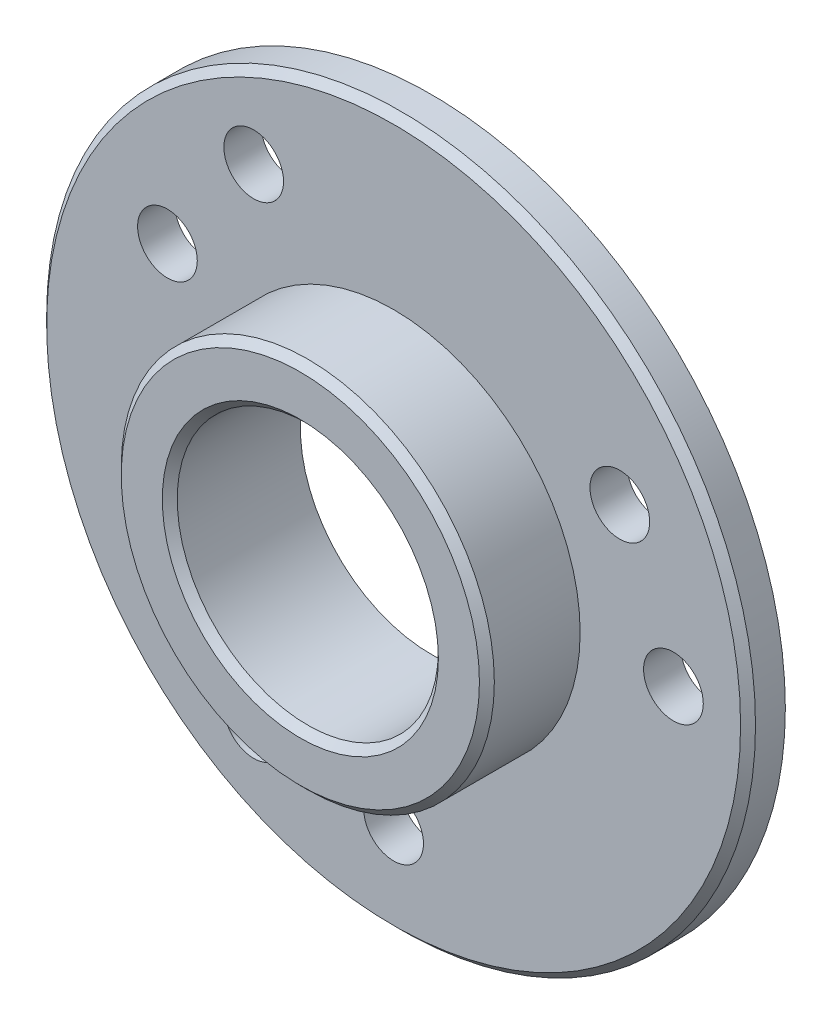
from build123d import *

# Parameters (mm, degrees)
SKETCH_1_R      = 19
SKETCH_1_R_2    = 7
SKETCH_1_R_3    = 1.6
EXTRUDE_1_DEPTH = 2
SKETCH_1_3_R    = 10
SKETCH_1_3_R_2  = 7
EXTRUDE_2_DEPTH = 7
CHAMFER_1_SIZE  = 0.4


with BuildPart() as part:
    # 草图1 → 凸台-拉伸1 (new body)
    with BuildSketch(Plane.XY):
        Circle(SKETCH_1_R)
        Circle(SKETCH_1_R_2, mode=Mode.SUBTRACT)
        with Locations((-7.5, -12.990381057)):
            Circle(SKETCH_1_R_3, mode=Mode.SUBTRACT)
        with Locations((0, -14)):
            Circle(SKETCH_1_R_3, mode=Mode.SUBTRACT)
        with Locations((15, 0)):
            Circle(SKETCH_1_R_3, mode=Mode.SUBTRACT)
        with Locations((-12.124355653, 7)):
            Circle(SKETCH_1_R_3, mode=Mode.SUBTRACT)
        with Locations((-7.5, 12.990381057)):
            Circle(SKETCH_1_R_3, mode=Mode.SUBTRACT)
        with Locations((12.124355653, 7)):
            Circle(SKETCH_1_R_3, mode=Mode.SUBTRACT)
    extrude(amount=EXTRUDE_1_DEPTH)

    # 草图1<3> → 凸台-拉伸2 (add)
    with BuildSketch(Plane.XY):
        Circle(SKETCH_1_3_R)
        Circle(SKETCH_1_3_R_2, mode=Mode.SUBTRACT)
    extrude(amount=EXTRUDE_2_DEPTH)

    # 倒角1
    chamfer_1_edges = [part.edges().sort_by_distance(p)[0] for p in [
        (-19, 0, 2),
        (-7, 0, 7),
        (-10, 0, 7),
    ]]
    chamfer(chamfer_1_edges, length=CHAMFER_1_SIZE)


solid = part.part
